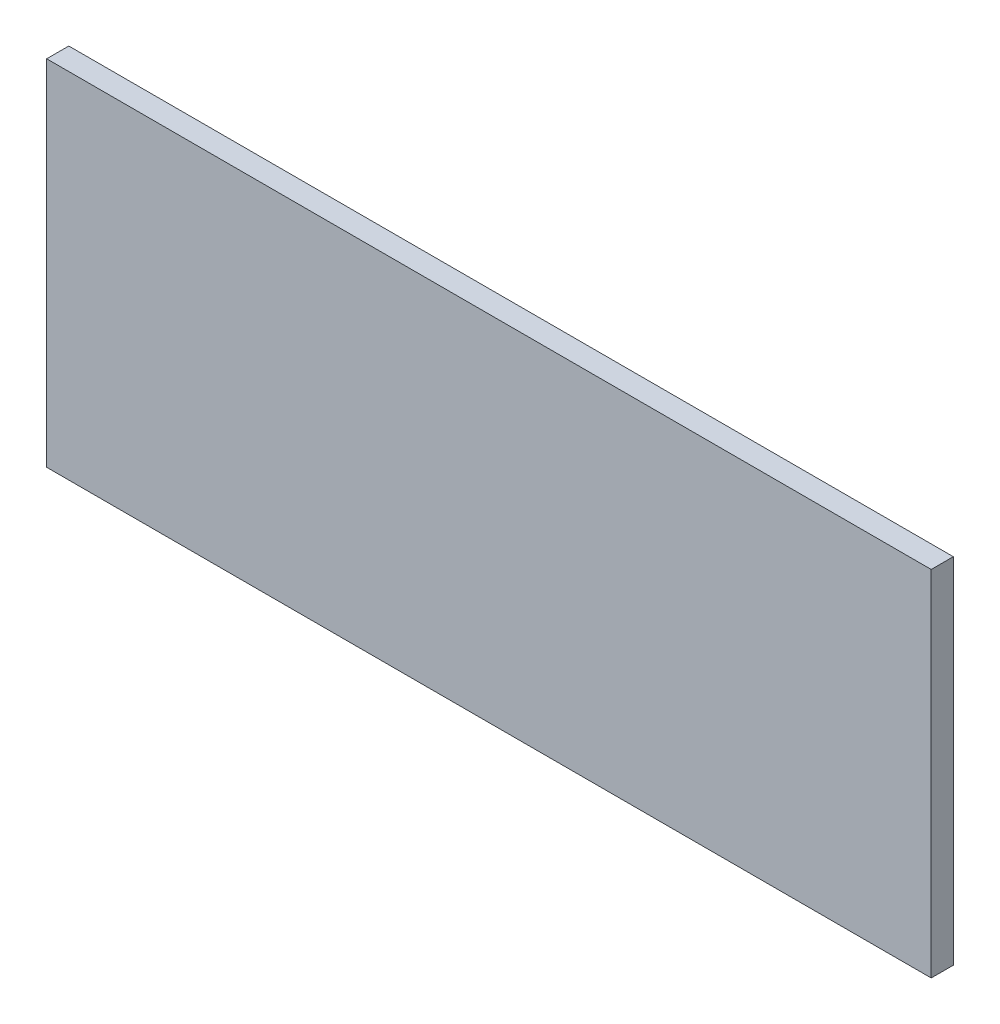
from build123d import *

# Parameters (mm, degrees)
SKETCH_1_W      = 200
SKETCH_1_H      = 80
EXTRUDE_1_DEPTH = 2.5


with BuildPart() as part:
    # 草图1 → 凸台-拉伸1 (new, symmetric)
    with BuildSketch(Plane.XY):
        Rectangle(SKETCH_1_W, SKETCH_1_H)
    extrude(amount=EXTRUDE_1_DEPTH, both=True)


solid = part.part
